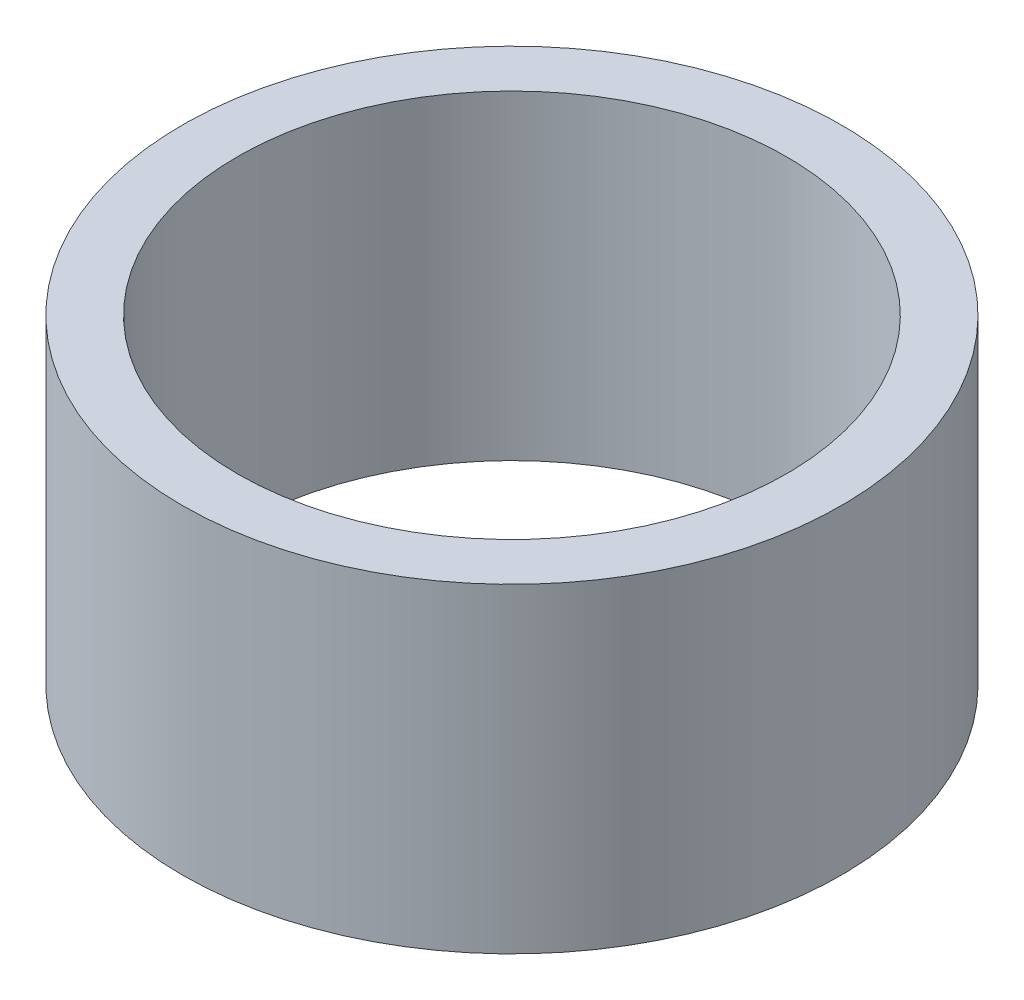
from build123d import *

# Parameters (mm, degrees)
SKETCH1_R           = 9.525
SKETCH1_R_2         = 7.9375
BOSS_EXTRUDE1_DEPTH = 9.25


with BuildPart() as part:
    # Sketch1 → Boss-Extrude1 (new body)
    with BuildSketch(Plane(origin=(0, 0, 0), x_dir=(1, 0, 0), z_dir=(0, 1, 0))):
        with Locations(Location((0, 0, 0), (0, 0, 270))):
            Circle(SKETCH1_R)
        with Locations(Location((0, 0, 0), (0, 0, 270))):
            Circle(SKETCH1_R_2, mode=Mode.SUBTRACT)
    extrude(amount=BOSS_EXTRUDE1_DEPTH)


solid = part.part
